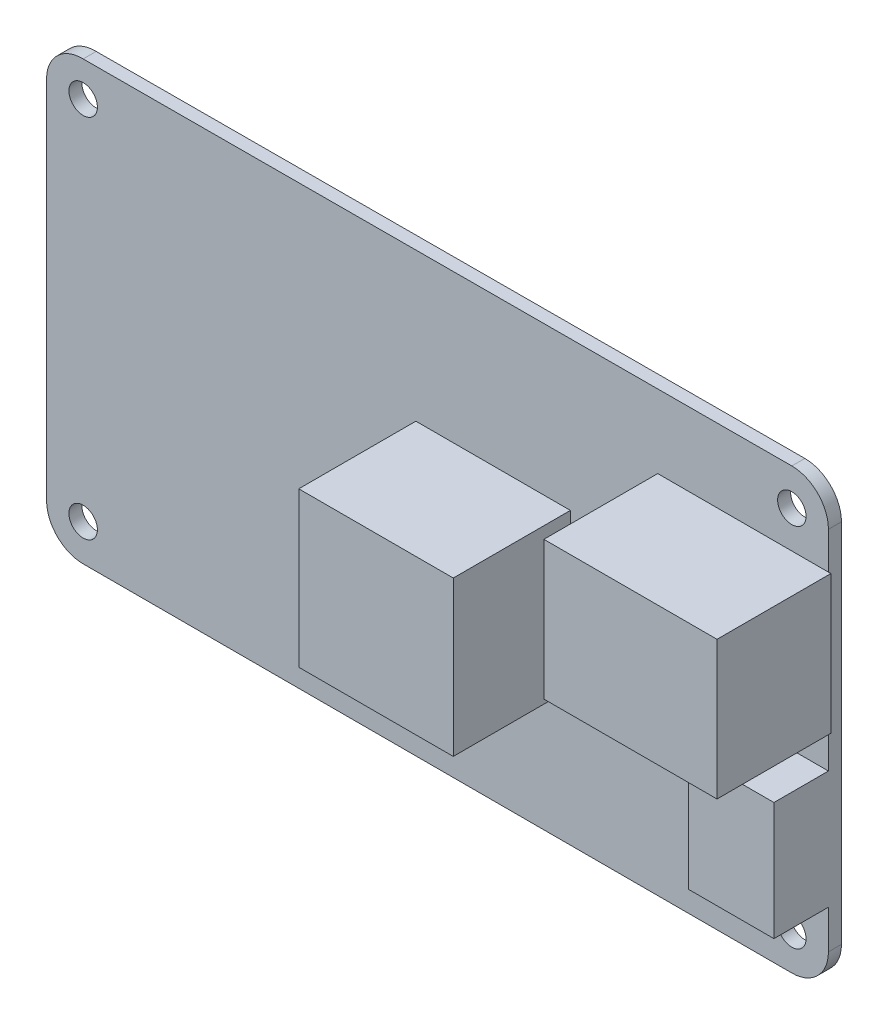
from build123d import *

# Parameters (mm, degrees)
PCB_R              = 1.75
BOARD_DEPTH        = 1.6
GIGE_W             = 21.29
GIGE_H             = 17.01
ETHERNETPORT_DEPTH = 14
HDMI_W             = 10.5
HDMI_H             = 14.5
HDMIPORT_DEPTH     = 6.7
SKETCH9_W          = 19
SKETCH9_H          = 19
FPGAANDFAN_DEPTH   = 14.4


with BuildPart() as part:
    # pcb → board (new body)
    with BuildSketch(Plane.XY.offset(-31.428393775)):
        with BuildLine():
            Line((91.850829578, -91.451333311), (91.850829578, -136.451333311))
            ThreePointArc((91.850829578, -136.451333311), (90.532810093, -139.633313826), (87.350829578, -140.951333311))
            Line((87.350829578, -140.951333311), (0.210829578, -140.951333311))
            ThreePointArc((0.210829578, -140.951333311), (-2.971150937, -139.633313826), (-4.289170422, -136.451333311))
            Line((-4.289170422, -136.451333311), (-4.289170422, -91.451333311))
            ThreePointArc((-4.289170422, -91.451333311), (-2.923602921, -88.384143861), (0.210829578, -87.180915442))
            Line((0.210829578, -87.180915442), (87.350829578, -86.951333311))
            ThreePointArc((87.350829578, -86.951333311), (90.532810093, -88.269352795), (91.850829578, -91.451333311))
        make_face()
        with Locations((87.350829578, -136.451333311)):
            Circle(PCB_R, mode=Mode.SUBTRACT)
        with Locations((87.350829578, -91.451333311)):
            Circle(PCB_R, mode=Mode.SUBTRACT)
        with Locations((0.210829578, -91.451333311)):
            Circle(PCB_R, mode=Mode.SUBTRACT)
        with Locations((0.210829578, -136.451333311)):
            Circle(PCB_R, mode=Mode.SUBTRACT)
    extrude(amount=BOARD_DEPTH)

    # gige → ethernetport (add)
    with BuildSketch(Plane.XY.offset(-29.828393775)):
        with Locations((81.505829578, -104.516333311)):
            Rectangle(GIGE_W, GIGE_H)
    extrude(amount=ETHERNETPORT_DEPTH)

    # hdmi → hdmiport (add)
    with BuildSketch(Plane.XY.offset(-29.828393775)):
        with Locations((86.600829578, -124.441333311)):
            Rectangle(HDMI_W, HDMI_H)
    extrude(amount=HDMIPORT_DEPTH)

    # Sketch9 → FPGAandFan (add)
    with BuildSketch(Plane.XY.offset(-29.828393775)):
        with Locations((50.620829578, -114.802468161)):
            Rectangle(SKETCH9_W, SKETCH9_H)
    extrude(amount=FPGAANDFAN_DEPTH)


solid = part.part
